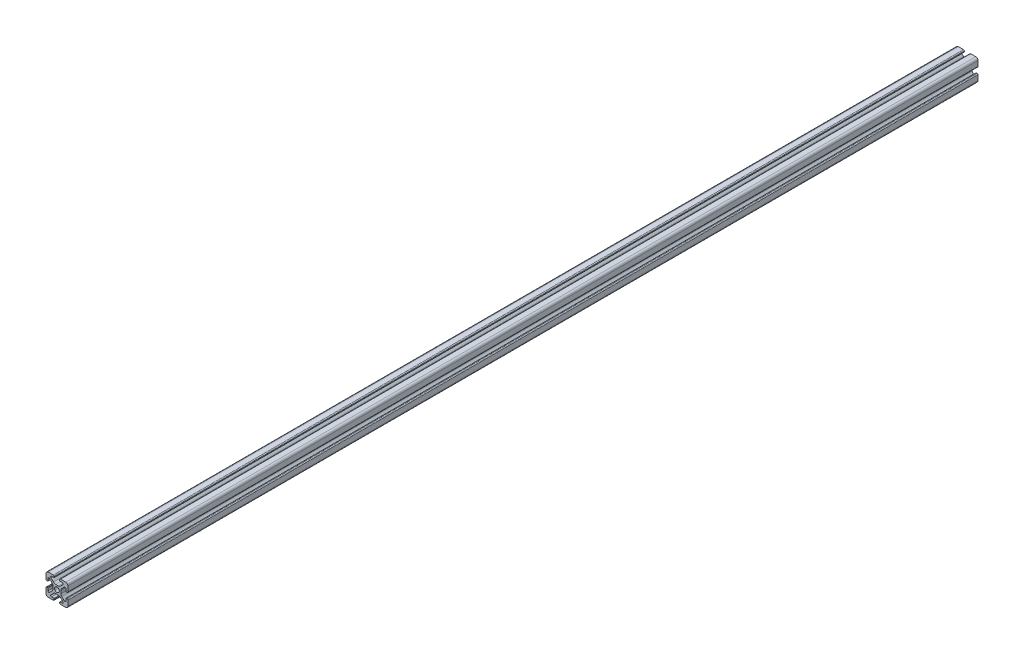
from build123d import *

# Parameters (mm, degrees)
ESQUISSE1_R        = 2.15
BOSS_EXTRU_1_DEPTH = 832


with BuildPart() as part:
    # Esquisse1 → Boss.-Extru.1 (new body)
    with BuildSketch(Plane(origin=(0, 0, 0), x_dir=(-1, 0, 0), z_dir=(0, 0, -1))):
        with BuildLine():
            Line((-20, 6.7), (-20, 2))
            ThreePointArc((-20, 2), (-19.414213562, 0.585786438), (-18, 0))
            Line((-18, 0), (-13.3, 0))
            ThreePointArc((-13.3, 0), (-12.734314575, 0.234314575), (-12.5, 0.8))
            Line((-12.5, 0.8), (-12.5, 1.5))
            ThreePointArc((-12.5, 1.5), (-12.587867966, 1.712132034), (-12.8, 1.8))
            Line((-12.8, 1.8), (-14.918424061, 1.8))
            ThreePointArc((-14.918424061, 1.8), (-15.686700051, 2.313345604), (-15.506437047, 3.219588924))
            Line((-15.506437047, 3.219588924), (-13.254705627, 5.471320344))
            ThreePointArc((-13.254705627, 5.471320344), (-12.281435581, 6.121638598), (-11.133385284, 6.35))
            Line((-11.133385284, 6.35), (-8.866614716, 6.35))
            ThreePointArc((-8.866614716, 6.35), (-7.718564419, 6.121638598), (-6.745294373, 5.471320344))
            Line((-6.745294373, 5.471320344), (-4.493562953, 3.219588924))
            ThreePointArc((-4.493562953, 3.219588924), (-4.313299949, 2.313345604), (-5.081575939, 1.8))
            Line((-5.081575939, 1.8), (-7.2, 1.8))
            ThreePointArc((-7.2, 1.8), (-7.412132034, 1.712132034), (-7.5, 1.5))
            Line((-7.5, 1.5), (-7.5, 0.8))
            ThreePointArc((-7.5, 0.8), (-7.265685425, 0.234314575), (-6.7, 0))
            Line((-6.7, 0), (-2, 0))
            ThreePointArc((-2, 0), (-0.585786438, 0.585786438), (0, 2))
            Line((0, 2), (0, 6.7))
            ThreePointArc((0, 6.7), (-0.234314575, 7.265685425), (-0.8, 7.5))
            Line((-0.8, 7.5), (-1.5, 7.5))
            ThreePointArc((-1.5, 7.5), (-1.712132034, 7.412132034), (-1.8, 7.2))
            Line((-1.8, 7.2), (-1.8, 5.081575939))
            ThreePointArc((-1.8, 5.081575939), (-2.313345604, 4.313299949), (-3.219588924, 4.493562953))
            Line((-3.219588924, 4.493562953), (-5.471320344, 6.745294373))
            ThreePointArc((-5.471320344, 6.745294373), (-6.121638598, 7.718564419), (-6.35, 8.866614716))
            Line((-6.35, 8.866614716), (-6.35, 11.133385284))
            ThreePointArc((-6.35, 11.133385284), (-6.121638598, 12.281435581), (-5.471320344, 13.254705627))
            Line((-5.471320344, 13.254705627), (-3.219588924, 15.506437047))
            ThreePointArc((-3.219588924, 15.506437047), (-2.313345604, 15.686700051), (-1.8, 14.918424061))
            Line((-1.8, 14.918424061), (-1.8, 12.8))
            ThreePointArc((-1.8, 12.8), (-1.712132034, 12.587867966), (-1.5, 12.5))
            Line((-1.5, 12.5), (-0.8, 12.5))
            ThreePointArc((-0.8, 12.5), (-0.234314575, 12.734314575), (0, 13.3))
            Line((0, 13.3), (0, 18))
            ThreePointArc((0, 18), (-0.585786438, 19.414213562), (-2, 20))
            Line((-2, 20), (-6.7, 20))
            ThreePointArc((-6.7, 20), (-7.265685425, 19.765685425), (-7.5, 19.2))
            Line((-7.5, 19.2), (-7.5, 18.5))
            ThreePointArc((-7.5, 18.5), (-7.412132034, 18.287867966), (-7.2, 18.2))
            Line((-7.2, 18.2), (-5.081575939, 18.2))
            ThreePointArc((-5.081575939, 18.2), (-4.313299949, 17.686654396), (-4.493562953, 16.780411076))
            Line((-4.493562953, 16.780411076), (-6.745294373, 14.528679656))
            ThreePointArc((-6.745294373, 14.528679656), (-7.718564419, 13.878361402), (-8.866614716, 13.65))
            Line((-8.866614716, 13.65), (-11.133385284, 13.65))
            ThreePointArc((-11.133385284, 13.65), (-12.281435581, 13.878361402), (-13.254705627, 14.528679656))
            Line((-13.254705627, 14.528679656), (-15.506437047, 16.780411076))
            ThreePointArc((-15.506437047, 16.780411076), (-15.686700051, 17.686654396), (-14.918424061, 18.2))
            Line((-14.918424061, 18.2), (-12.8, 18.2))
            ThreePointArc((-12.8, 18.2), (-12.587867966, 18.287867966), (-12.5, 18.5))
            Line((-12.5, 18.5), (-12.5, 19.2))
            ThreePointArc((-12.5, 19.2), (-12.734314575, 19.765685425), (-13.3, 20))
            Line((-13.3, 20), (-18, 20))
            ThreePointArc((-18, 20), (-19.414213562, 19.414213562), (-20, 18))
            Line((-20, 18), (-20, 13.3))
            ThreePointArc((-20, 13.3), (-19.765685425, 12.734314575), (-19.2, 12.5))
            Line((-19.2, 12.5), (-18.5, 12.5))
            ThreePointArc((-18.5, 12.5), (-18.287867966, 12.587867966), (-18.2, 12.8))
            Line((-18.2, 12.8), (-18.2, 14.918424061))
            ThreePointArc((-18.2, 14.918424061), (-17.686654396, 15.686700051), (-16.780411076, 15.506437047))
            Line((-16.780411076, 15.506437047), (-14.528679656, 13.254705627))
            ThreePointArc((-14.528679656, 13.254705627), (-13.878361402, 12.281435581), (-13.65, 11.133385284))
            Line((-13.65, 11.133385284), (-13.65, 8.866614716))
            ThreePointArc((-13.65, 8.866614716), (-13.878361402, 7.718564419), (-14.528679656, 6.745294373))
            Line((-14.528679656, 6.745294373), (-16.780411076, 4.493562953))
            ThreePointArc((-16.780411076, 4.493562953), (-17.686654396, 4.313299949), (-18.2, 5.081575939))
            Line((-18.2, 5.081575939), (-18.2, 7.2))
            ThreePointArc((-18.2, 7.2), (-18.287867966, 7.412132034), (-18.5, 7.5))
            Line((-18.5, 7.5), (-19.2, 7.5))
            ThreePointArc((-19.2, 7.5), (-19.765685425, 7.265685425), (-20, 6.7))
        make_face()
        with Locations((-10, 10)):
            Circle(ESQUISSE1_R, mode=Mode.SUBTRACT)
    extrude(amount=-BOSS_EXTRU_1_DEPTH)


solid = part.part
